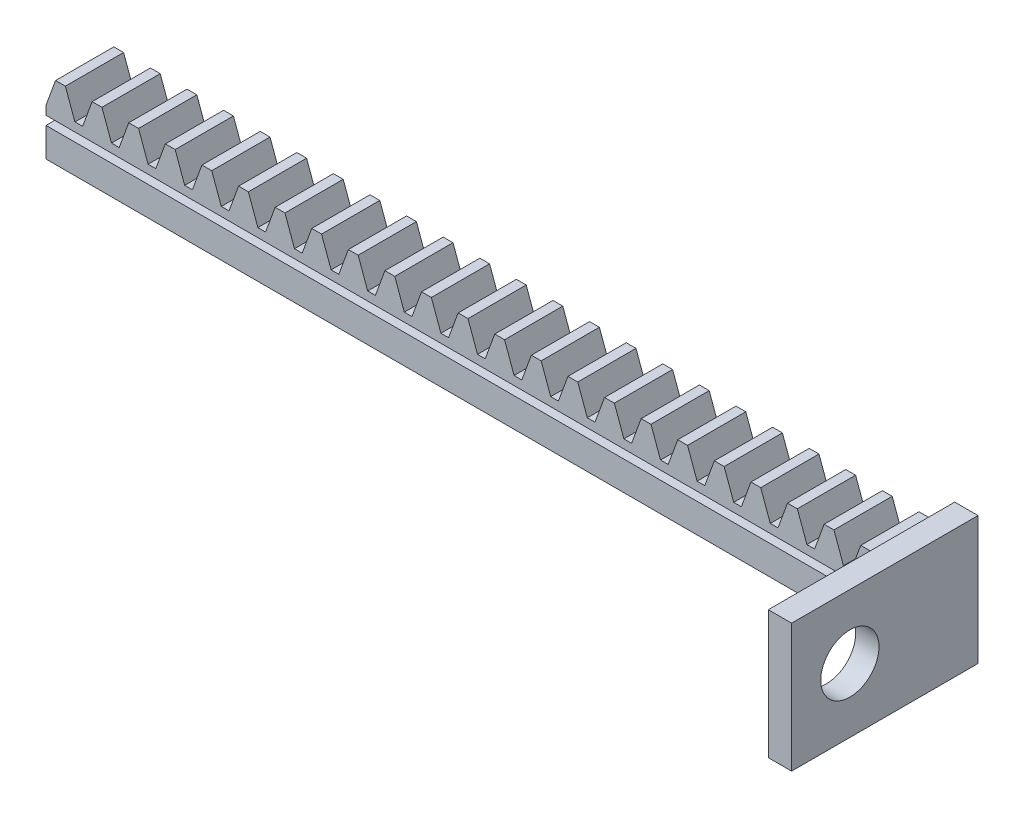
from build123d import *

# Parameters (mm, degrees)
SKETCH_1_W             = 150
SKETCH_1_H             = 8
EXTRUDE_1_DEPTH        = 10
EXTRUDE_2_DEPTH        = 10
PATTERN_LINEAR_1_COUNT = 24
PATTERN_LINEAR_1_PITCH = 6.283185307
SKETCH_3_W             = 2
SKETCH_3_H             = 1.5
CUT_EXTRUDE_1_DEPTH    = 151.545674132
SKETCH_4_W             = 32
SKETCH_4_H             = 22
SKETCH_4_R             = 5
EXTRUDE_1_2_DEPTH      = 4


with BuildPart() as part:
    # 草图1 → Extrude 1 (new body)
    with BuildSketch(Plane.XY):
        with Locations((75, -4)):
            Rectangle(SKETCH_1_W, SKETCH_1_H)
    extrude(amount=EXTRUDE_1_DEPTH)

    # 草图2 → 拉伸2 (add)
    with BuildSketch(Plane.XY.offset(10)):
        Polygon((0, 0), (1.637866054, 4.5), (3.323577771, 4.5), (4.961443825, 0), align=None)
    extrude_2 = extrude(amount=-EXTRUDE_2_DEPTH)

    # 阵列(线性)1: 拉伸2 ×24
    with Locations(*[(i * PATTERN_LINEAR_1_PITCH, 0, 0) for i in range(1, PATTERN_LINEAR_1_COUNT)]):
        add(extrude_2)

    # 草图3 → 切除-拉伸1 (cut, through all)
    with BuildSketch(Plane.ZY):
        with Locations((9, -2.25)):
            Rectangle(SKETCH_3_W, SKETCH_3_H)
        with Locations((1, -5.25)):
            Rectangle(SKETCH_3_W, SKETCH_3_H)
    extrude(amount=-CUT_EXTRUDE_1_DEPTH, mode=Mode.SUBTRACT)

    # 草图4 → Extrude 1 2 (add)
    with BuildSketch(Plane(origin=(150, 0, 0), x_dir=(0, 0, -1), z_dir=(1, 0, 0))):
        with Locations((-16, -2)):
            Rectangle(SKETCH_4_W, SKETCH_4_H)
        with Locations((-22, -2)):
            Circle(SKETCH_4_R, mode=Mode.SUBTRACT)
    extrude(amount=-EXTRUDE_1_2_DEPTH)


solid = part.part
